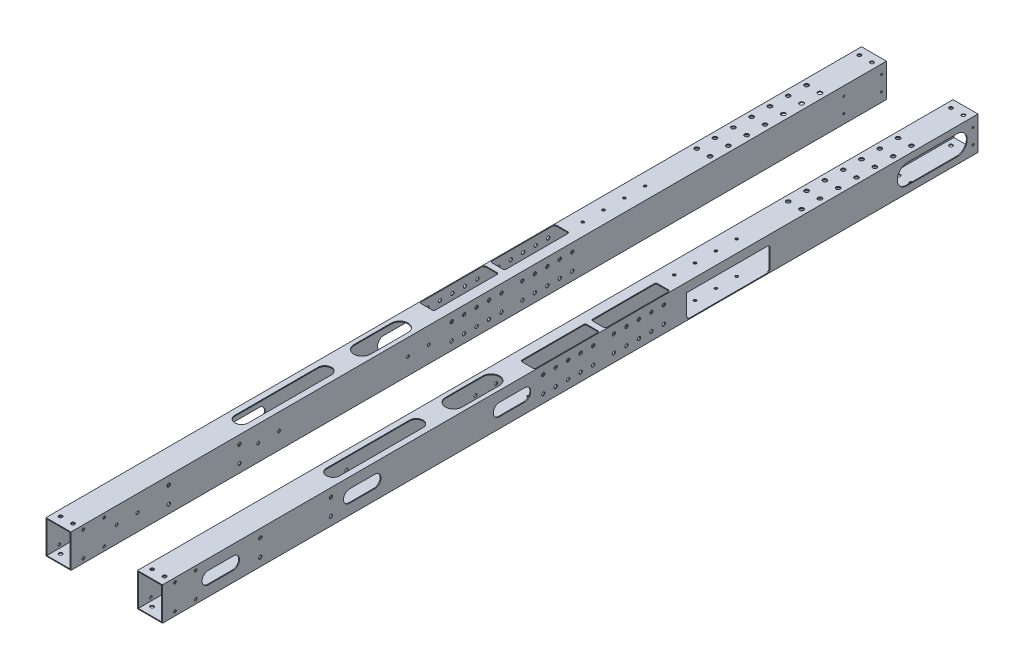
from build123d import *

# Parameters (mm, degrees)
SKETCH_1_W           = 30
SKETCH_1_H           = 40
SKETCH_1_W_2         = 28
SKETCH_1_H_2         = 38
EXTRUDE_1_DEPTH      = 940
SKETCH_5_R           = 2.5
CUT_EXTRUDE_3_DEPTH  = 941.97024395
CUT_EXTRUDE_4_DEPTH  = 1
SKETCH_7_R           = 1.75
CUT_EXTRUDE_5_DEPTH  = 1
SKETCH_17_W          = 30
SKETCH_17_H          = 40
SKETCH_17_W_2        = 28
SKETCH_17_H_2        = 38
EXTRUDE_2_DEPTH      = 20
SKETCH_18_W          = 30
SKETCH_18_H          = 40
SKETCH_18_W_2        = 28
SKETCH_18_H_2        = 38
EXTRUDE_3_DEPTH      = 20
SKETCH_19_R          = 2.1
CUT_EXTRUDE_16_DEPTH = 961.950050731
SKETCH_20_R          = 1.6
CUT_EXTRUDE_17_DEPTH = 961.67684473
SKETCH_26_R          = 2
CUT_EXTRUDE_22_DEPTH = 961.67684473
CUT_EXTRUDE_START    = -20
SKETCH_34_R          = 1.75
CUT_EXTRUDE_29_DEPTH = 20
SKETCH_35_R          = 1.5
CUT_EXTRUDE_30_DEPTH = 10
CUT_EXTRUDE_31_DEPTH = 10
SKETCH_37_R          = 1.65
CUT_EXTRUDE_32_DEPTH = 52
SKETCH_40_W          = 100
SKETCH_40_H          = 28
CUT_EXTRUDE_34_DEPTH = 10
EXTRUDE_5_DEPTH      = 1
SKETCH_43_W          = 38.522995696
SKETCH_43_H          = 13.00002022
EXTRUDE_6_DEPTH      = 1
FILLET_1_R           = 3
CUT_EXTRUDE_35_DEPTH = 10
SKETCH_45_R          = 1.1
CUT_EXTRUDE_36_DEPTH = 71
CUT_EXTRUDE_37_DEPTH = 10
SKETCH_47_W          = 19.401524295
SKETCH_47_H          = 15.190340728
EXTRUDE_7_DEPTH      = 1
SKETCH_48_R          = 2
CUT_EXTRUDE_38_DEPTH = 51
CUT_EXTRUDE_39_DEPTH = 11
SKETCH_51_W          = 17
SKETCH_51_H          = 78
CUT_EXTRUDE_40_DEPTH = 11
FILLET_2_R           = 2


with BuildPart() as part:
    # 草图1 → 凸台-拉伸1 (new body)
    with BuildSketch(Plane.XY):
        Rectangle(SKETCH_1_W, SKETCH_1_H)
        Rectangle(SKETCH_1_W_2, SKETCH_1_H_2, mode=Mode.SUBTRACT)
    extrude(amount=EXTRUDE_1_DEPTH)

    # 草图5 → 切除-拉伸3 (cut, through all)
    with BuildSketch(Plane.XZ.offset(20)):
        with Locations((-8, 53)):
            Circle(SKETCH_5_R)
        with Locations((8, 53)):
            Circle(SKETCH_5_R)
        with Locations((-8, 97)):
            Circle(SKETCH_5_R)
        with Locations((8, 97)):
            Circle(SKETCH_5_R)
        with Locations((-8, 119)):
            Circle(SKETCH_5_R)
        with Locations((8, 119)):
            Circle(SKETCH_5_R)
        with Locations((-8, 141)):
            Circle(SKETCH_5_R)
        with Locations((8, 141)):
            Circle(SKETCH_5_R)
        with Locations((-8, 163)):
            Circle(SKETCH_5_R)
        with Locations((8, 163)):
            Circle(SKETCH_5_R)
        with Locations((-8, 185)):
            Circle(SKETCH_5_R)
        with Locations((8, 185)):
            Circle(SKETCH_5_R)
        with Locations((-8, 75)):
            Circle(SKETCH_5_R)
        with Locations((8, 75)):
            Circle(SKETCH_5_R)
    extrude(amount=-CUT_EXTRUDE_3_DEPTH, mode=Mode.SUBTRACT)

    # 草图6 → 切除-拉伸4 (cut)
    with BuildSketch(Plane(origin=(15, 0, 0), x_dir=(0, 0, -1), z_dir=(1, 0, 0))):
        with BuildLine():
            Line((-345, -7.5), (-375, -7.5))
            ThreePointArc((-375, -7.5), (-382.5, 0), (-375, 7.5))
            Line((-375, 7.5), (-345, 7.5))
            ThreePointArc((-345, 7.5), (-337.5, 0), (-345, -7.5))
        make_face()
        with BuildLine():
            Line((-525, -7.5), (-555, -7.5))
            ThreePointArc((-555, -7.5), (-562.5, 0), (-555, 7.5))
            Line((-555, 7.5), (-525, 7.5))
            ThreePointArc((-525, 7.5), (-517.5, 0), (-525, -7.5))
        make_face()
        with BuildLine():
            Line((-705, -7.5), (-735, -7.5))
            ThreePointArc((-735, -7.5), (-742.5, 0), (-735, 7.5))
            Line((-735, 7.5), (-705, 7.5))
            ThreePointArc((-705, 7.5), (-697.5, 0), (-705, -7.5))
        make_face()
    extrude(amount=-CUT_EXTRUDE_4_DEPTH, mode=Mode.SUBTRACT)

    # 草图7 → 切除-拉伸5 (cut)
    with BuildSketch(Plane.ZY.offset(15)):
        with Locations((350, 0)):
            Circle(SKETCH_7_R)
        with Locations((375, 0)):
            Circle(SKETCH_7_R)
        with Locations((530, 0)):
            Circle(SKETCH_7_R)
        with Locations((555, 0)):
            Circle(SKETCH_7_R)
        with Locations((710, 0)):
            Circle(SKETCH_7_R)
        with Locations((735, 0)):
            Circle(SKETCH_7_R)
    extrude(amount=-CUT_EXTRUDE_5_DEPTH, mode=Mode.SUBTRACT)

    # 草图17 → 凸台-拉伸2 (add)
    with BuildSketch(Plane.XY.offset(940)):
        Rectangle(SKETCH_17_W, SKETCH_17_H)
        Rectangle(SKETCH_17_W_2, SKETCH_17_H_2, mode=Mode.SUBTRACT)
    extrude(amount=EXTRUDE_2_DEPTH)

    # 草图18 → 凸台-拉伸3 (add)
    with BuildSketch(Plane(origin=(0, 0, 0), x_dir=(-1, 0, 0), z_dir=(0, 0, -1))):
        Rectangle(SKETCH_18_W, SKETCH_18_H)
        Rectangle(SKETCH_18_W_2, SKETCH_18_H_2, mode=Mode.SUBTRACT)
    extrude(amount=EXTRUDE_3_DEPTH)

    # 草图19 → 切除-拉伸16 (cut, through all)
    with BuildSketch(Plane(origin=(0, 20, 0), x_dir=(1, 0, 0), z_dir=(0, 1, 0))):
        with Locations((-7.5, -950)):
            Circle(SKETCH_19_R)
        with Locations((7.5, -950)):
            Circle(SKETCH_19_R)
        with Locations((-7.5, 10)):
            Circle(SKETCH_19_R)
        with Locations((7.5, 10)):
            Circle(SKETCH_19_R)
    extrude(amount=-CUT_EXTRUDE_16_DEPTH, mode=Mode.SUBTRACT)

    # 草图20 → 切除-拉伸17 (cut, through all)
    with BuildSketch(Plane(origin=(15, 0, 0), x_dir=(0, 0, -1), z_dir=(1, 0, 0))):
        with Locations((-945, 15)):
            Circle(SKETCH_20_R)
        with Locations((-920, 15)):
            Circle(SKETCH_20_R)
        with Locations((-920, -15)):
            Circle(SKETCH_20_R)
        with Locations((-945, -15)):
            Circle(SKETCH_20_R)
    extrude(amount=-CUT_EXTRUDE_17_DEPTH, mode=Mode.SUBTRACT)

    # 草图26 → 切除-拉伸22 (cut, through all)
    with BuildSketch(Plane(origin=(15, 0, 0), x_dir=(0, 0, -1), z_dir=(1, 0, 0))):
        with Locations((-842.5, 10)):
            Circle(SKETCH_26_R)
        with Locations((-842.5, -10)):
            Circle(SKETCH_26_R)
        with Locations((-757.5, -10)):
            Circle(SKETCH_26_R)
        with Locations((-757.5, 10)):
            Circle(SKETCH_26_R)
    extrude(amount=-CUT_EXTRUDE_22_DEPTH, mode=Mode.SUBTRACT)

    # 草图34 → 切除-拉伸29 (cut)
    with BuildSketch(Plane(origin=(15, 0, 0), x_dir=(0, 0, -1), z_dir=(1, 0, 0)).offset(CUT_EXTRUDE_START)):
        with Locations((-905, 0)):
            Circle(SKETCH_34_R)
        with Locations((-880, 0)):
            Circle(SKETCH_34_R)
    extrude(amount=-CUT_EXTRUDE_29_DEPTH, mode=Mode.SUBTRACT)

    # 草图35 → 切除-拉伸30 (cut)
    with BuildSketch(Plane.XZ.offset(20)):
        with Locations((5, 720)):
            Circle(SKETCH_35_R)
        with Locations((5, 700)):
            Circle(SKETCH_35_R)
        with Locations((5, 680)):
            Circle(SKETCH_35_R)
        with Locations((5, 660)):
            Circle(SKETCH_35_R)
        with Locations((5, 640)):
            Circle(SKETCH_35_R)
        with Locations((5, 740)):
            Circle(SKETCH_35_R)
    extrude(amount=-CUT_EXTRUDE_30_DEPTH, mode=Mode.SUBTRACT)

    # 草图36 → 切除-拉伸31 (cut)
    with BuildSketch(Plane(origin=(0, 20, 0), x_dir=(1, 0, 0), z_dir=(0, 1, 0))):
        with BuildLine():
            Line((8, -640), (8, -740))
            ThreePointArc((8, -740), (0, -748), (-8, -740))
            Line((-8, -740), (-8, -640))
            ThreePointArc((-8, -640), (0, -632), (8, -640))
        make_face()
    extrude(amount=-CUT_EXTRUDE_31_DEPTH, mode=Mode.SUBTRACT)

    # 草图37 → 切除-拉伸32 (cut)
    with BuildSketch(Plane(origin=(0, 20, 0), x_dir=(1, 0, 0), z_dir=(0, 1, 0))):
        with Locations((0, -255)):
            Circle(SKETCH_37_R)
        with Locations((0, -280)):
            Circle(SKETCH_37_R)
        with Locations((0, -330)):
            Circle(SKETCH_37_R)
        with Locations((0, -305)):
            Circle(SKETCH_37_R)
        with Locations((0, -355)):
            Circle(SKETCH_37_R)
        with Locations((0, -380)):
            Circle(SKETCH_37_R)
        with Locations((0, -405)):
            Circle(SKETCH_37_R)
        with Locations((0, -455)):
            Circle(SKETCH_37_R)
        with Locations((0, -480)):
            Circle(SKETCH_37_R)
        with Locations((0, -505)):
            Circle(SKETCH_37_R)
        with Locations((0, -555)):
            Circle(SKETCH_37_R)
        with Locations((0, -580)):
            Circle(SKETCH_37_R)
    extrude(amount=-CUT_EXTRUDE_32_DEPTH, mode=Mode.SUBTRACT)

    # 草图40 → 切除-拉伸34 (cut)
    with BuildSketch(Plane(origin=(15, 0, 0), x_dir=(0, 0, -1), z_dir=(1, 0, 0))):
        with Locations((-280, -5)):
            Rectangle(SKETCH_40_W, SKETCH_40_H)
    extrude(amount=-CUT_EXTRUDE_34_DEPTH, mode=Mode.SUBTRACT)

    # 草图42 → 凸台-拉伸5 (add)
    with BuildSketch(Plane(origin=(15, 0, 0), x_dir=(0, 0, -1), z_dir=(1, 0, 0))):
        Polygon((-350, -8.24794841), (-350, -4), (-334.23295051, -4), (-334.23295051, 12.222841732), (-383.610977641, 12.222841732), (-383.610977641, -8.24794841), align=None)
    extrude(amount=-EXTRUDE_5_DEPTH)

    # 草图43 → 凸台-拉伸6 (add)
    with BuildSketch(Plane.ZY.offset(15)):
        with Locations((362.400416305, 1.435266839)):
            Rectangle(SKETCH_43_W, SKETCH_43_H)
    extrude(amount=-EXTRUDE_6_DEPTH)

    # 圆角1
    fillet_1_edges = [part.edges().sort_by_distance(p)[0] for p in [
        (14.5, -19, 230),
        (14.5, 9, 230),
        (14.5, -19, 330),
    ]]
    fillet(fillet_1_edges, radius=FILLET_1_R)

    # 草图44 → 切除-拉伸35 (cut)
    with BuildSketch(Plane(origin=(15, 0, 0), x_dir=(0, 0, -1), z_dir=(1, 0, 0))):
        with BuildLine():
            ThreePointArc((-875, -7.5), (-867.5, 0), (-875, 7.5))
            Line((-875, 7.5), (-905, 7.5))
            ThreePointArc((-905, 7.5), (-912.5, 0), (-905, -7.5))
            Line((-905, -7.5), (-875, -7.5))
        make_face()
    extrude(amount=-CUT_EXTRUDE_35_DEPTH, mode=Mode.SUBTRACT)

    # 草图45 → 切除-拉伸36 (cut)
    with BuildSketch(Plane(origin=(15, 0, 0), x_dir=(0, 0, -1), z_dir=(1, 0, 0))):
        with Locations((-31.199995376, 9.020444537)):
            Circle(SKETCH_45_R)
        with Locations((14, 9)):
            Circle(SKETCH_45_R)
        with Locations((14, -9)):
            Circle(SKETCH_45_R)
        with Locations((-31.199995376, -9.020444537)):
            Circle(SKETCH_45_R)
    extrude(amount=-CUT_EXTRUDE_36_DEPTH, mode=Mode.SUBTRACT)

    # 草图46 → 切除-拉伸37 (cut)
    with BuildSketch(Plane(origin=(15, 0, 0), x_dir=(0, 0, -1), z_dir=(1, 0, 0))):
        with BuildLine():
            Line((-65, 12), (-5, 12))
            ThreePointArc((-5, 12), (7, 0), (-5, -12))
            Line((-5, -12), (-65, -12))
            ThreePointArc((-65, -12), (-77, 0), (-65, 12))
        make_face()
    extrude(amount=-CUT_EXTRUDE_37_DEPTH, mode=Mode.SUBTRACT)

    # 草图47 → 凸台-拉伸7 (add)
    with BuildSketch(Plane(origin=(15, 0, 0), x_dir=(0, 0, -1), z_dir=(1, 0, 0))):
        with Locations((-344.839367804, -3.918550489)):
            Rectangle(SKETCH_47_W, SKETCH_47_H)
    extrude(amount=-EXTRUDE_7_DEPTH)

    # 草图48 → 切除-拉伸38 (cut)
    with BuildSketch(Plane(origin=(15, 0, 0), x_dir=(0, 0, -1), z_dir=(1, 0, 0))):
        with Locations((-842.5, -10)):
            Circle(SKETCH_48_R)
        with Locations((-842.5, 10)):
            Circle(SKETCH_48_R)
        with Locations((-472.5, -10)):
            Circle(SKETCH_48_R)
        with Locations((-472.5, 10)):
            Circle(SKETCH_48_R)
        with Locations((-387.5, -10)):
            Circle(SKETCH_48_R)
        with Locations((-387.5, 10)):
            Circle(SKETCH_48_R)
        with Locations((-457.5, -10)):
            Circle(SKETCH_48_R)
        with Locations((-457.5, 10)):
            Circle(SKETCH_48_R)
        with Locations((-372.5, -10)):
            Circle(SKETCH_48_R)
        with Locations((-372.5, 10)):
            Circle(SKETCH_48_R)
        with Locations((-442.5, -10)):
            Circle(SKETCH_48_R)
        with Locations((-442.5, 10)):
            Circle(SKETCH_48_R)
        with Locations((-357.5, -10)):
            Circle(SKETCH_48_R)
        with Locations((-357.5, 10)):
            Circle(SKETCH_48_R)
        with Locations((-402.5, -10)):
            Circle(SKETCH_48_R)
        with Locations((-402.5, 10)):
            Circle(SKETCH_48_R)
        with Locations((-487.5, -10)):
            Circle(SKETCH_48_R)
        with Locations((-487.5, 10)):
            Circle(SKETCH_48_R)
        with Locations((-417.5, -10)):
            Circle(SKETCH_48_R)
        with Locations((-417.5, 10)):
            Circle(SKETCH_48_R)
        with Locations((-502.5, -10)):
            Circle(SKETCH_48_R)
        with Locations((-502.5, 10)):
            Circle(SKETCH_48_R)
    extrude(amount=-CUT_EXTRUDE_38_DEPTH, mode=Mode.SUBTRACT)

    # 草图49 → 切除-拉伸39 (cut)
    with BuildSketch(Plane(origin=(0, 20, 0), x_dir=(1, 0, 0), z_dir=(0, 1, 0))):
        with BuildLine():
            Line((10, -550), (10, -595))
            ThreePointArc((10, -595), (0, -605), (-10, -595))
            Line((-10, -595), (-10, -550))
            ThreePointArc((-10, -550), (0, -540), (10, -550))
        make_face()
    extrude(amount=-CUT_EXTRUDE_39_DEPTH, mode=Mode.SUBTRACT)

    # 草图51 → 切除-拉伸40 (cut)
    with BuildSketch(Plane(origin=(0, 20, 0), x_dir=(1, 0, 0), z_dir=(0, 1, 0))):
        with Locations((5.5, -473)):
            Rectangle(SKETCH_51_W, SKETCH_51_H)
        with Locations((5.5, -388)):
            Rectangle(SKETCH_51_W, SKETCH_51_H)
    extrude(amount=-CUT_EXTRUDE_40_DEPTH, mode=Mode.SUBTRACT)

    # 圆角2
    fillet_2_edges = [part.edges().sort_by_distance(p)[0] for p in [
        (14, 19.5, 427),
        (14, 19.5, 349),
        (14, 19.5, 512),
        (14, 19.5, 434),
        (-3, 19.5, 434),
        (-3, 19.5, 512),
        (-3, 19.5, 427),
        (-3, 19.5, 349),
    ]]
    fillet(fillet_2_edges, radius=FILLET_2_R)


with BuildPart() as body_2:
    # 镜向27: mirrored copy
    add(part.part.mirror(Plane.ZY.offset(55)))


solid = Compound([part.part, body_2.part])
